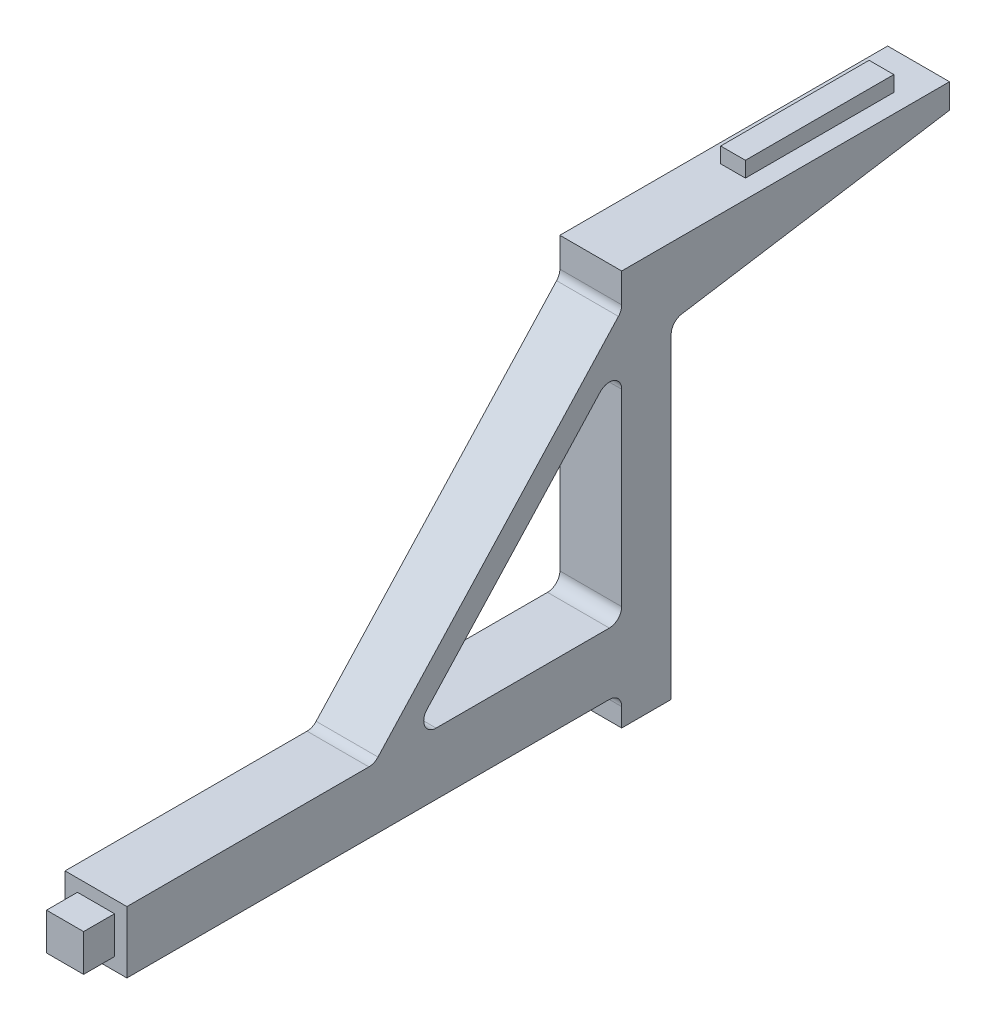
from build123d import *

# Parameters (mm, degrees)
SKETCH1_R           = 5.08
SKETCH1_R_2         = 1.778
BOSS_EXTRUDE1_DEPTH = 10.16
SKETCH3_W           = 12.7
SKETCH3_H           = 12.7
BOSS_EXTRUDE2_DEPTH = 101.6
SKETCH6_W           = 7.62
SKETCH6_H           = 7.62
BOSS_EXTRUDE3_DEPTH = 6.35
BOSS_EXTRUDE4_START = -12.7
BOSS_EXTRUDE4_DEPTH = 12.7
FILLET2_R           = 2.54
BOSS_EXTRUDE5_START = -12.7
SKETCH7_W           = 57.15
SKETCH7_H           = 5.08
BOSS_EXTRUDE5_DEPTH = 12.7
SKETCH9_W           = 25.4
SKETCH9_H           = 25.4
CUT_EXTRUDE1_DEPTH  = 111.76
BOSS_EXTRUDE6_DEPTH = 12.7
FILLET3_R           = 2.54
SKETCH12_W          = 5.08
SKETCH12_H          = 30.48
BOSS_EXTRUDE7_DEPTH = 3.175
SKETCH13_W          = 7.874
SKETCH13_H          = 7.874
CUT_EXTRUDE3_DEPTH  = 6.35


with BuildPart() as part:
    # Sketch1 → Boss-Extrude1 (new body)
    with BuildSketch(Plane.XY):
        with BuildLine():
            Line((-6.35, 12.7), (-6.35, 10.998522628))
            ThreePointArc((-6.35, 10.998522628), (0, -12.7), (6.35, 10.998522628))
            Line((6.35, 10.998522628), (6.35, 43.18))
            Line((6.35, 43.18), (6.35, 93.98))
            Line((6.35, 93.98), (-6.35, 93.98))
            Line((-6.35, 93.98), (-6.35, 12.7))
        make_face()
        Circle(SKETCH1_R, mode=Mode.SUBTRACT)
        with Locations((0, 8.128)):
            Circle(SKETCH1_R_2, mode=Mode.SUBTRACT)
        with Locations((8.128, 0)):
            Circle(SKETCH1_R_2, mode=Mode.SUBTRACT)
        with Locations((0, -8.128)):
            Circle(SKETCH1_R_2, mode=Mode.SUBTRACT)
        with Locations((-8.128, 0)):
            Circle(SKETCH1_R_2, mode=Mode.SUBTRACT)
    extrude(amount=BOSS_EXTRUDE1_DEPTH)

    # Sketch3 → Boss-Extrude2 (add)
    with BuildSketch(Plane.XY.offset(10.16)):
        with Locations((0, 25.4)):
            Rectangle(SKETCH3_W, SKETCH3_H)
    extrude(amount=BOSS_EXTRUDE2_DEPTH)

    # Sketch6 → Boss-Extrude3 (add)
    with BuildSketch(Plane.XY.offset(111.76)):
        with Locations((0, 25.4)):
            Rectangle(SKETCH6_W, SKETCH6_H)
    extrude(amount=BOSS_EXTRUDE3_DEPTH)

    # Sketch5 → Boss-Extrude4 (add)
    with BuildSketch(Plane.ZY.offset(6.35).offset(BOSS_EXTRUDE4_START)):
        Polygon((31.75, 63.5), (60.96, 31.75), (54.057179058, 31.75), (49.383579058, 36.83), (29.520779058, 58.42), (10.16, 79.464325063), (10.16, 86.967391304), align=None)
    extrude(amount=BOSS_EXTRUDE4_DEPTH)

    # Fillet2
    fillet2_edges = [part.edges().sort_by_distance(p)[0] for p in [
        (0, 31.75, 60.96),
    ]]
    fillet(fillet2_edges, radius=FILLET2_R)

    # Sketch7 → Boss-Extrude5 (add)
    with BuildSketch(Plane(origin=(6.35, 0, 0), x_dir=(0, 0, -1), z_dir=(1, 0, 0)).offset(BOSS_EXTRUDE5_START)):
        with Locations((28.575, 91.44)):
            Rectangle(SKETCH7_W, SKETCH7_H)
    extrude(amount=BOSS_EXTRUDE5_DEPTH)

    # Sketch9 → Cut-Extrude1 (cut)
    with BuildSketch(Plane.XY.offset(111.76)):
        Rectangle(SKETCH9_W, SKETCH9_H)
    extrude(amount=-CUT_EXTRUDE1_DEPTH, mode=Mode.SUBTRACT)

    # Sketch11 → Boss-Extrude6 (add)
    with BuildSketch(Plane(origin=(6.35, 0, 0), x_dir=(0, 0, -1), z_dir=(1, 0, 0))):
        Polygon((0, 79.814999882), (57.15, 88.9), (0, 88.9), align=None)
    extrude(amount=-BOSS_EXTRUDE6_DEPTH)

    # Fillet3
    fillet3_edges = [part.edges().sort_by_distance(p)[0] for p in [
        (0, 79.814999882, 0),
        (0, 31.75, 10.16),
        (0, 19.05, 10.16),
        (0, 86.967391304, 10.16),
        (0, 79.464325063, 10.16),
        (0, 31.75, 54.057179058),
    ]]
    fillet(fillet3_edges, radius=FILLET3_R)

    # Sketch12 → Boss-Extrude7 (add)
    with BuildSketch(Plane(origin=(0, 93.98, 0), x_dir=(1, 0, 0), z_dir=(0, 1, 0))):
        with Locations((0, 34.29)):
            Rectangle(SKETCH12_W, SKETCH12_H)
    extrude(amount=BOSS_EXTRUDE7_DEPTH)

    # Sketch13 → Cut-Extrude3 (cut)
    with BuildSketch(Plane.XZ.offset(-12.7)):
        with Locations((0, 5.08)):
            Rectangle(SKETCH13_W, SKETCH13_H)
    extrude(amount=-CUT_EXTRUDE3_DEPTH, mode=Mode.SUBTRACT)


solid = part.part
